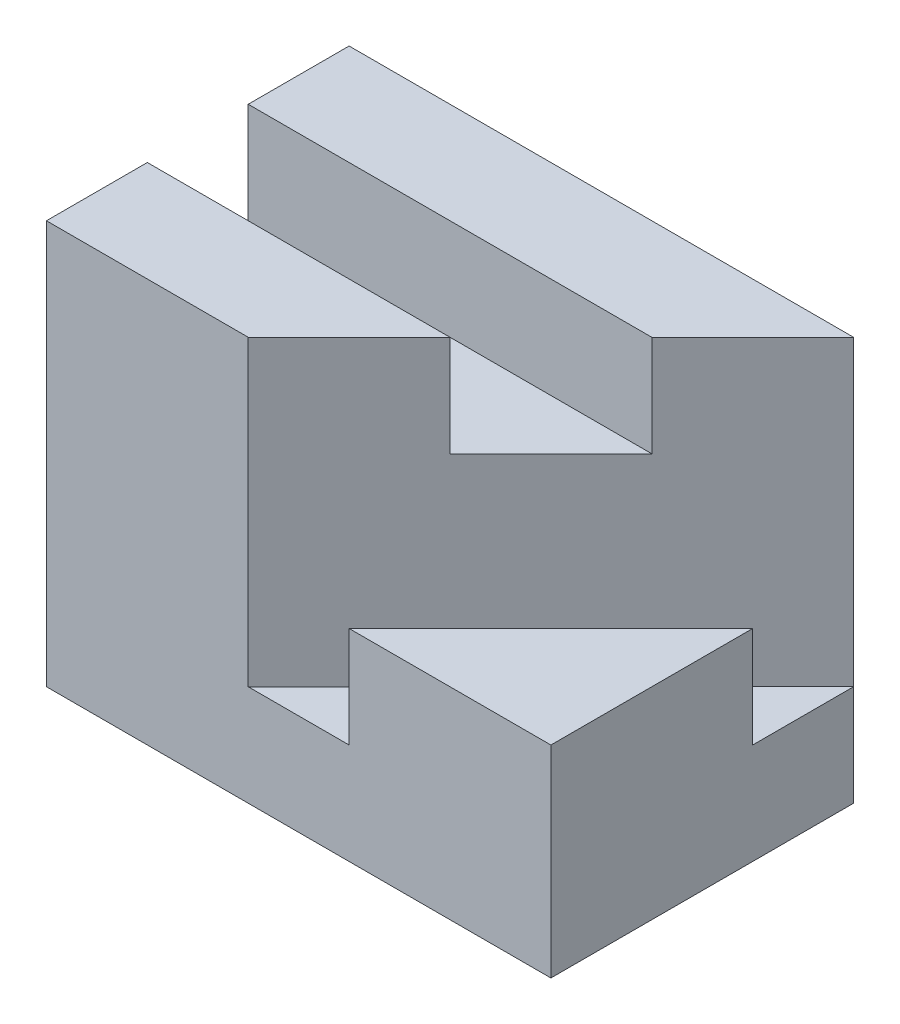
from build123d import *

# Parameters (mm, degrees)
EXTRUDE_1_DEPTH     = 25
CUT_EXTRUDE_2_DEPTH = 15
CUT_EXTRUDE_3_DEPTH = 10


with BuildPart() as part:
    # 草圖1 → 填料-伸長1 (new body)
    with BuildSketch(Plane(origin=(0, 0, 0), x_dir=(0, 0, -1), z_dir=(1, 0, 0))):
        Polygon((2.5, 10), (7.5, 10), (7.5, -10), (-7.5, -10), (-7.5, 10), (-2.5, 10), (-2.5, 5), (2.5, 5), align=None)
    extrude(amount=-EXTRUDE_1_DEPTH)

    # 草圖2 → 除料-伸長2 (cut)
    with BuildSketch(Plane(origin=(0, 10, 0), x_dir=(1, 0, 0), z_dir=(0, 1, 0))):
        Polygon((0, 2.5), (-10, -7.5), (-15, -7.5), (0, 7.5), align=None)
    extrude(amount=-CUT_EXTRUDE_2_DEPTH, mode=Mode.SUBTRACT)

    # 草圖3 → 除料-伸長3 (cut)
    with BuildSketch(Plane(origin=(0, 10, 0), x_dir=(1, 0, 0), z_dir=(0, 1, 0))):
        Polygon((0, -2.5), (0, 2.5), (-5, -2.5), align=None)
        Polygon((0, -7.5), (0, -2.5), (-5, -2.5), (-10, -7.5), align=None)
    extrude(amount=-CUT_EXTRUDE_3_DEPTH, mode=Mode.SUBTRACT)


solid = part.part
